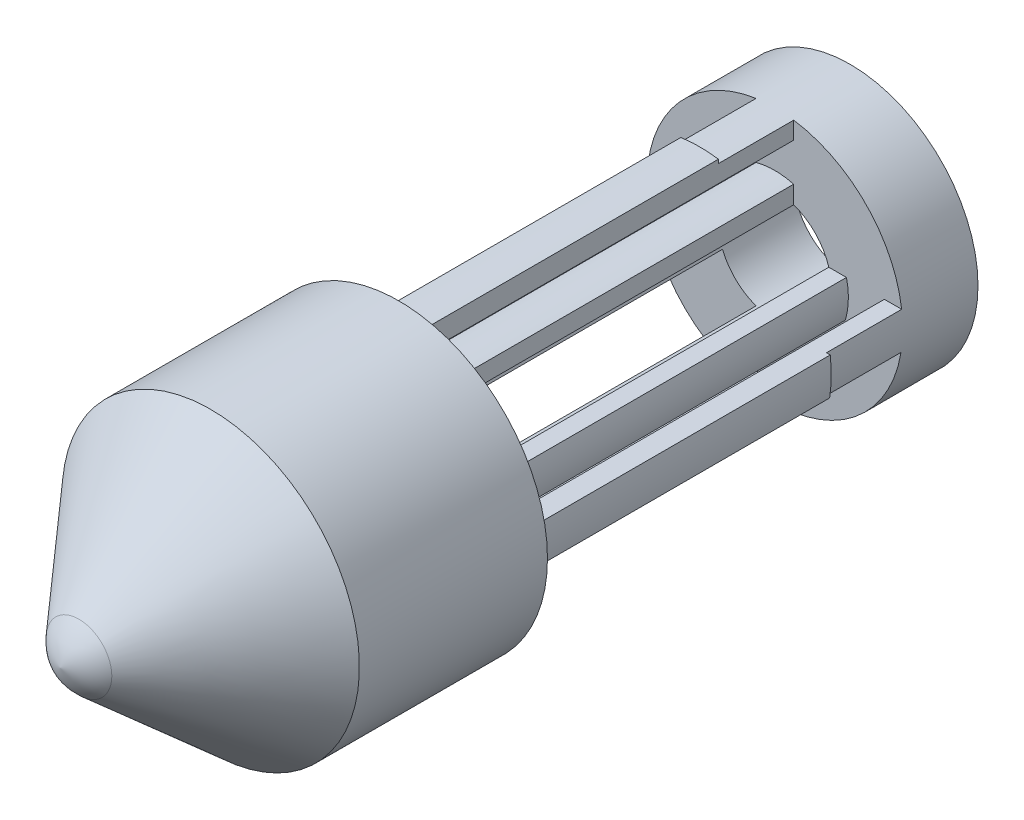
from build123d import *
from build123d.topology import SkipClean

# Parameters (mm, degrees)
CROQUIS1_R              = 7
CROQUIS1_R_2            = 3
SALIENTE_EXTRUIR1_DEPTH = 1
CROQUIS2_R              = 7
CROQUIS2_R_2            = 3
SALIENTE_EXTRUIR2_DEPTH = 3
SALIENTE_EXTRUIR4_DEPTH = 30
CROQUIS6_R              = 7.907043309
SALIENTE_EXTRUIR6_DEPTH = 10
CROQUIS8_R              = 7
CROQUIS8_R_2            = 6.8
CORTAR_EXTRUIR2_DEPTH   = 8


with BuildPart() as part:
    # Croquis1 → Saliente-Extruir1 (new body)
    with BuildSketch(Plane.XY):
        Circle(CROQUIS1_R)
        Circle(CROQUIS1_R_2, mode=Mode.SUBTRACT)
    extrude(amount=SALIENTE_EXTRUIR1_DEPTH)

    # Croquis2 → Saliente-Extruir2 (add)
    with BuildSketch(Plane.XY.offset(1)):
        Circle(CROQUIS2_R)
        Circle(CROQUIS2_R_2, mode=Mode.SUBTRACT)
    extrude(amount=SALIENTE_EXTRUIR2_DEPTH)

    # Croquis3 → Saliente-Extruir4 (add)
    with SkipClean():  # the faces are left unmerged after this step: merging them gives an invalid solid
        with BuildSketch(Plane.XY.offset(4)):
            with BuildLine():
                Line((-5.821783288, 0.885286665), (-6.943793453, 0.885286665))
                ThreePointArc((-6.943793453, 0.885286665), (-6.9990427, -0.115763932), (-6.910718044, -1.114439821))
                Line((-6.910718044, -1.114439821), (-5.782293405, -1.114439821))
                ThreePointArc((-5.782293405, -1.114439821), (-5.887561081, -0.11626545), (-5.821783288, 0.885286665))
            make_face()
            with BuildLine():
                Line((-3.744731139, -1.114439821), (-2.785322941, -1.114439821))
                ThreePointArc((-2.785322941, -1.114439821), (-2.997537106, -0.12153722), (-2.866403238, 0.885286665))
                Line((-2.866403238, 0.885286665), (-3.80542441, 0.885286665))
                ThreePointArc((-3.80542441, 0.885286665), (-3.905245025, -0.118527256), (-3.744731139, -1.114439821))
            make_face()
            with BuildLine():
                Line((6.943793453, 0.885286665), (5.821783288, 0.885286665))
                ThreePointArc((5.821783288, 0.885286665), (5.887561081, -0.11626545), (5.782293405, -1.114439821))
                Line((5.782293405, -1.114439821), (6.910718044, -1.114439821))
                ThreePointArc((6.910718044, -1.114439821), (6.9990427, -0.115763932), (6.943793453, 0.885286665))
            make_face()
            with BuildLine():
                Line((-1, 6.92820323), (-1, 5.803179571))
                ThreePointArc((-1, 5.803179571), (0, 5.888708953), (1, 5.803179571))
                Line((1, 5.803179571), (1, 6.92820323))
                ThreePointArc((1, 6.92820323), (0, 7), (-1, 6.92820323))
            make_face()
            with BuildLine():
                Line((1, -6.92820323), (1, -5.803179571))
                ThreePointArc((1, -5.803179571), (0, -5.888708953), (-1, -5.803179571))
                Line((-1, -5.803179571), (-1, -6.92820323))
                ThreePointArc((-1, -6.92820323), (0, -7), (1, -6.92820323))
            make_face()
            with BuildLine():
                Line((-1, 3.776901828), (-1, 2.828427125))
                ThreePointArc((-1, 2.828427125), (0, 3), (1, 2.828427125))
                Line((1, 2.828427125), (1, 3.776901828))
                ThreePointArc((1, 3.776901828), (0, 3.907043309), (-1, 3.776901828))
            make_face()
            with BuildLine():
                Line((3.80542441, 0.885286665), (2.866403238, 0.885286665))
                ThreePointArc((2.866403238, 0.885286665), (2.997537106, -0.12153722), (2.785322941, -1.114439821))
                Line((2.785322941, -1.114439821), (3.744731139, -1.114439821))
                ThreePointArc((3.744731139, -1.114439821), (3.905245025, -0.118527256), (3.80542441, 0.885286665))
            make_face()
            with BuildLine():
                Line((1, -3.776901828), (1, -2.828427125))
                ThreePointArc((1, -2.828427125), (0, -3), (-1, -2.828427125))
                Line((-1, -2.828427125), (-1, -3.776901828))
                ThreePointArc((-1, -3.776901828), (0, -3.907043309), (1, -3.776901828))
            make_face()
        extrude(amount=SALIENTE_EXTRUIR4_DEPTH)

    # Croquis8 → Cortar-Extruir2 (cut)
    with SkipClean():  # the faces are left unmerged after this step: merging them gives an invalid solid
        with BuildSketch(Plane(origin=(0, 0, 0), x_dir=(-1, 0, 0), z_dir=(0, 0, -1))):
            Circle(CROQUIS8_R)
            Circle(CROQUIS8_R_2, mode=Mode.SUBTRACT)
        extrude(amount=-CORTAR_EXTRUIR2_DEPTH, mode=Mode.SUBTRACT)


with BuildPart() as body_2:
    # Croquis6 → Saliente-Extruir6 (new body)
    with BuildSketch(Plane.XY.offset(24)):
        Circle(CROQUIS6_R)
        with BuildLine():
            Line((-5.461571503, 1.185286665), (-7.203130953, 1.185286665))
            ThreePointArc((-7.203130953, 1.185286665), (-7.299071326, -0.116437848), (-7.161659025, -1.414439821))
            Line((-7.161659025, -1.414439821), (-5.406757601, -1.414439821))
            ThreePointArc((-5.406757601, -1.414439821), (-5.587467121, -0.117808884), (-5.461571503, 1.185286665))
        make_face(mode=Mode.SUBTRACT)
        with BuildLine():
            Line((-1.3, -5.435408702), (-1.3, -7.183313998))
            ThreePointArc((-1.3, -7.183313998), (0, -7.3), (1.3, -7.183313998))
            Line((1.3, -7.183313998), (1.3, -5.435408702))
            ThreePointArc((1.3, -5.435408702), (0, -5.588708953), (-1.3, -5.435408702))
        make_face(mode=Mode.SUBTRACT)
        with BuildLine():
            Line((5.406757601, -1.414439821), (7.161659025, -1.414439821))
            ThreePointArc((7.161659025, -1.414439821), (7.299071326, -0.116437848), (7.203130953, 1.185286665))
            Line((7.203130953, 1.185286665), (5.461571503, 1.185286665))
            ThreePointArc((5.461571503, 1.185286665), (5.587467121, -0.117808884), (5.406757601, -1.414439821))
        make_face(mode=Mode.SUBTRACT)
        with BuildLine():
            Line((1.3, 5.435408702), (1.3, 7.183313998))
            ThreePointArc((1.3, 7.183313998), (0, 7.3), (-1.3, 7.183313998))
            Line((-1.3, 7.183313998), (-1.3, 5.435408702))
            ThreePointArc((-1.3, 5.435408702), (0, 5.588708953), (1.3, 5.435408702))
        make_face(mode=Mode.SUBTRACT)
        with BuildLine():
            Line((-3.962142526, -1.414439821), (-2.299860864, -1.414439821))
            ThreePointArc((-2.299860864, -1.414439821), (-2.69683136, -0.130769333), (-2.425921582, 1.185286665))
            Line((-2.425921582, 1.185286665), (-4.036620979, 1.185286665))
            ThreePointArc((-4.036620979, 1.185286665), (-4.205317925, -0.120476355), (-3.962142526, -1.414439821))
        make_face(mode=Mode.SUBTRACT)
        with BuildLine():
            Line((-1.3, 4.00115151), (-1.3, 2.366431913))
            ThreePointArc((-1.3, 2.366431913), (0, 2.7), (1.3, 2.366431913))
            Line((1.3, 2.366431913), (1.3, 4.00115151))
            ThreePointArc((1.3, 4.00115151), (0, 4.207043309), (-1.3, 4.00115151))
        make_face(mode=Mode.SUBTRACT)
        with BuildLine():
            Line((4.036620979, 1.185286665), (2.425921582, 1.185286665))
            ThreePointArc((2.425921582, 1.185286665), (2.69683136, -0.130769333), (2.299860864, -1.414439821))
            Line((2.299860864, -1.414439821), (3.962142526, -1.414439821))
            ThreePointArc((3.962142526, -1.414439821), (4.205317925, -0.120476355), (4.036620979, 1.185286665))
        make_face(mode=Mode.SUBTRACT)
        with BuildLine():
            Line((1.3, -4.00115151), (1.3, -2.366431913))
            ThreePointArc((1.3, -2.366431913), (0, -2.7), (-1.3, -2.366431913))
            Line((-1.3, -2.366431913), (-1.3, -4.00115151))
            ThreePointArc((-1.3, -4.00115151), (0, -4.207043309), (1.3, -4.00115151))
        make_face(mode=Mode.SUBTRACT)
    extrude(amount=SALIENTE_EXTRUIR6_DEPTH)

    # Croquis7 → Revolución1 (revolve)
    with BuildSketch(Plane(origin=(0, 0, 0), x_dir=(1, 0, 0), z_dir=(0, 1, 0)), mode=Mode.PRIVATE) as revoluci_n1_sk:
        with BuildLine():
            Line((0, -34), (7.907043309, -34))
            Line((7.907043309, -34), (1.748596789, -41.006354275))
            ThreePointArc((1.748596789, -41.006354275), (0.957796445, -41.649949765), (0, -41.999529956))
            Line((0, -41.999529956), (0, -34))
        make_face()
    revolve(revoluci_n1_sk.sketch.rotate(Axis((0, 0, 41.999529956), (0, 0, -1)), 180), axis=Axis((0, 0, 41.999529956), (0, 0, -1)))


solid = Compound([part.part, body_2.part])
